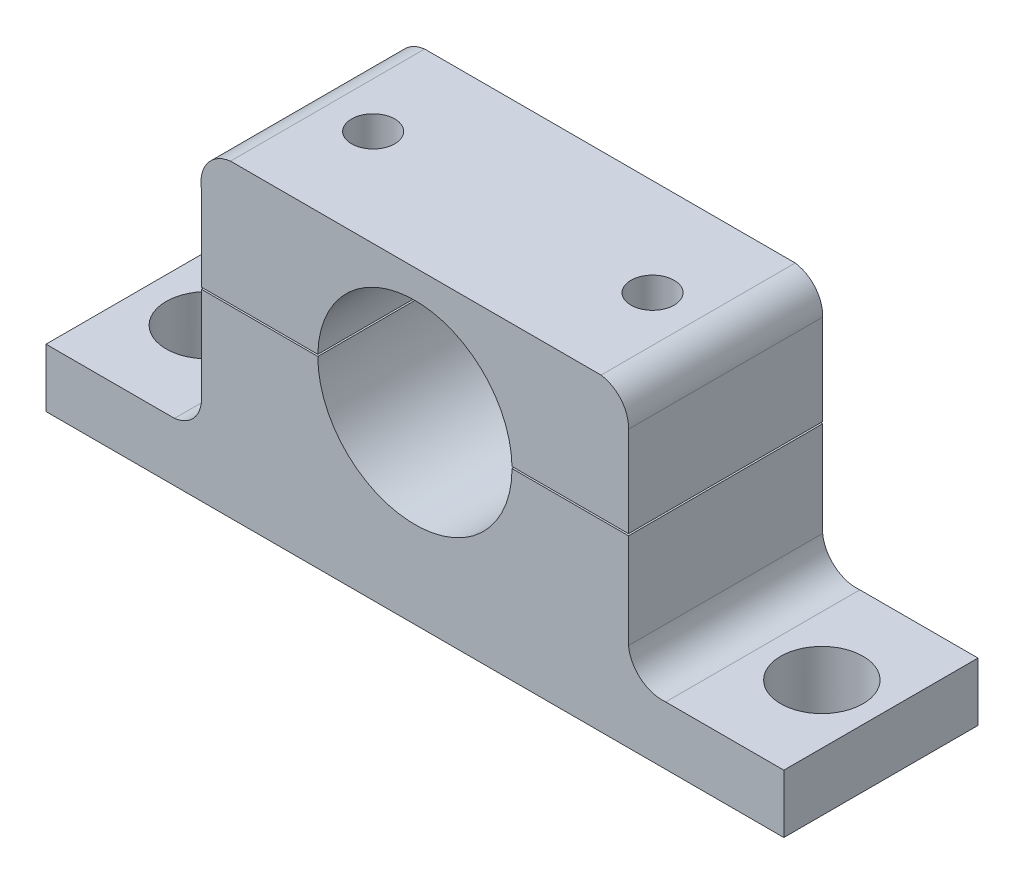
from build123d import *

# Parameters (mm, degrees)
ESBO_O1_R                  = 2.500659113
RESSALTO_EXTRUS_O1_DEPTH   = 5
CORTE_EXTRUS_O1_DEPTH      = 7
CORTE_EXTRUS_O1_DEPTH_BACK = 3
ESBO_O2_W                  = 15.499945442
ESBO_O2_H                  = 0.046559987
CORTE_EXTRUS_O2_DEPTH      = 1
CORTE_EXTRUS_O2_DEPTH_BACK = 2
ESBO_O3_R                  = 1.060761411
CORTE_EXTRUS_O3_DEPTH      = 1
CORTE_EXTRUS_O3_DEPTH_BACK = 9
ESBO_O4_R                  = 0.55636465


with BuildPart() as part:
    # Esboço1 → Ressalto-extrusão1 (new body)
    with BuildSketch(Plane.XY):
        with BuildLine():
            Line((-1.994581442, -5.203341468), (17.005418558, -5.203341468))
            Line((17.005418558, -5.203341468), (17.005418558, -3.700160989))
            Line((17.005418558, -3.700160989), (13.96315408, -3.700160989))
            ThreePointArc((13.96315408, -3.700160989), (13.323065801, -3.509293749), (13.005418558, -2.921719466))
            Line((13.005418558, -2.921719466), (13.005418558, 1.902771573))
            ThreePointArc((13.005418558, 1.902771573), (12.81558044, 2.465418863), (12.298336044, 2.757084288))
            Line((12.298336044, 2.757084288), (2.755939614, 2.757084288))
            ThreePointArc((2.755939614, 2.757084288), (2.170476224, 2.423277661), (2.005418558, 1.769863388))
            Line((2.005418558, 1.769863388), (2.005418558, -2.834609505))
            ThreePointArc((2.005418558, -2.834609505), (1.839014359, -3.410564702), (1.314086996, -3.700160989))
            Line((1.314086996, -3.700160989), (-1.994581442, -3.700160989))
            Line((-1.994581442, -3.700160989), (-1.994581442, -5.203341468))
        make_face()
        with Locations((7.505418558, -0.473834048)):
            Circle(ESBO_O1_R, mode=Mode.SUBTRACT)
    extrude(amount=RESSALTO_EXTRUS_O1_DEPTH)

    # Esboço2 → Corte-extrusão1 (cut, two sides: drawn at the far end of the back side and taken through both)
    with BuildSketch(Plane.XY.offset(-CORTE_EXTRUS_O1_DEPTH_BACK)):
        with Locations((7.749972721, -0.450554055)):
            Rectangle(ESBO_O2_W, ESBO_O2_H)
    extrude(amount=CORTE_EXTRUS_O1_DEPTH + CORTE_EXTRUS_O1_DEPTH_BACK, mode=Mode.SUBTRACT)


with BuildPart() as corte_extrus_o1_piece_1:
    # of the separate pieces the step leaves, piece 1, a body of its own (corte_extrus_o1_pieces)
    add(part.part.solids().sort_by_distance((2.005418558, -0.473834048, 0))[0])

    # Esboço3 → Corte-extrusão2 (cut, two sides: drawn at the far end of the back side and taken through both)
    with BuildSketch(Plane(origin=(0, -3.700160989, 0), x_dir=(1, 0, 0), z_dir=(0, 1, 0)).offset(-CORTE_EXTRUS_O2_DEPTH_BACK)):
        with Locations((15.484286319, -2.5)):
            Circle(ESBO_O3_R)
        with Locations((-0.340247223, -2.5)):
            Circle(ESBO_O3_R)
    extrude(amount=CORTE_EXTRUS_O2_DEPTH + CORTE_EXTRUS_O2_DEPTH_BACK, mode=Mode.SUBTRACT)


with BuildPart() as corte_extrus_o1_piece_2:
    # of the separate pieces the step leaves, piece 2, a body of its own (corte_extrus_o1_pieces)
    add(part.part.solids().sort_by_distance((2.005418558, 1.769863388, 0))[0])


with BuildPart() as corte_extrus_o3_tool:
    # Esboço4 → Corte-extrusão3 (new, two sides: drawn at the far end of the back side and taken through both)
    with BuildSketch(Plane(origin=(0, 2.757084288, 0), x_dir=(1, 0, 0), z_dir=(0, 1, 0)).offset(-CORTE_EXTRUS_O3_DEPTH_BACK)):
        with Locations((3.929895865, -2.5)):
            Circle(ESBO_O4_R)
        with Locations((11.12481326, -2.5)):
            Circle(ESBO_O4_R)
    extrude(amount=CORTE_EXTRUS_O3_DEPTH + CORTE_EXTRUS_O3_DEPTH_BACK)


with BuildPart() as corte_extrus_o1_piece_1_1:
    add(corte_extrus_o1_piece_1.part)

    # Corte-extrusão3: cut by corte_extrus_o3_tool
    add(corte_extrus_o3_tool.part, mode=Mode.SUBTRACT)


with BuildPart() as corte_extrus_o1_piece_2_1:
    add(corte_extrus_o1_piece_2.part)

    # Corte-extrusão3: cut by corte_extrus_o3_tool
    add(corte_extrus_o3_tool.part, mode=Mode.SUBTRACT)


solid = Compound([corte_extrus_o1_piece_1_1.part, corte_extrus_o1_piece_2_1.part])
